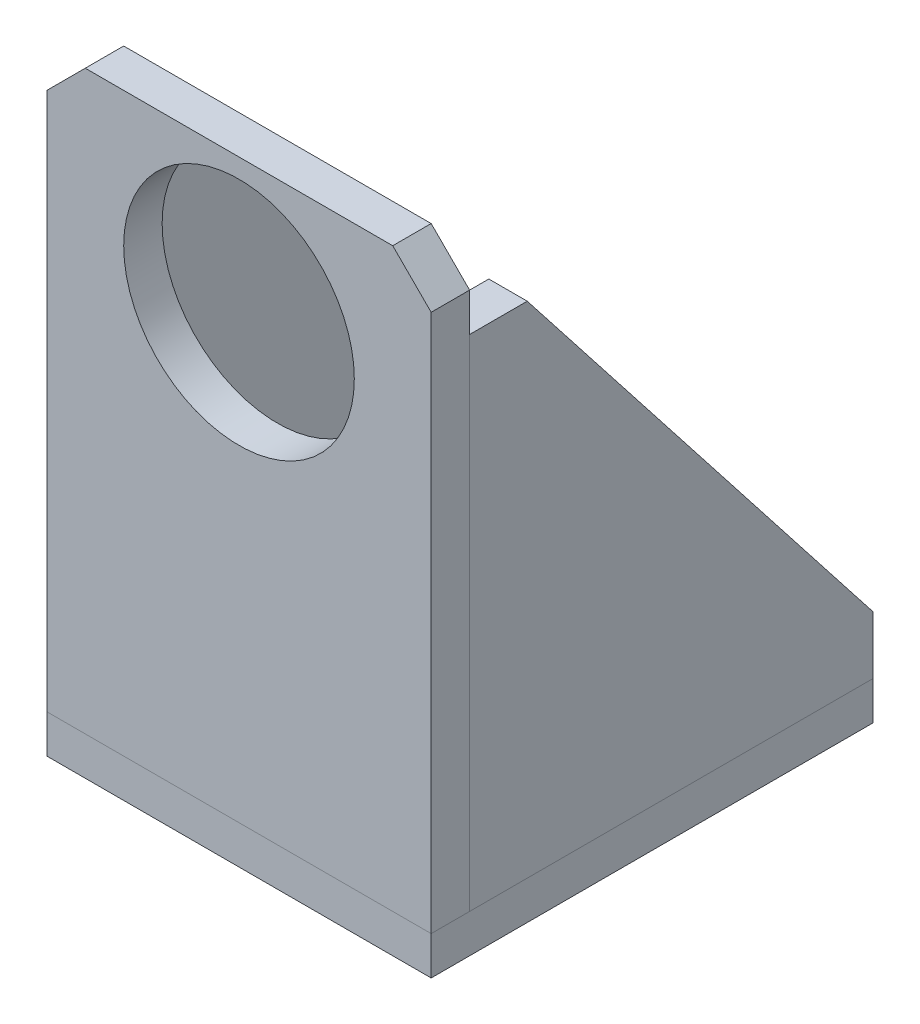
from build123d import *

# Parameters (mm, degrees)
SKETCH1_W           = 100
SKETCH1_H           = 150
BOSS_EXTRUDE1_DEPTH = 10
SKETCH3_W           = 100
SKETCH3_H           = 115
BOSS_EXTRUDE3_DEPTH = 10
BOSS_EXTRUDE4_DEPTH = 10
BOSS_EXTRUDE5_DEPTH = 10
CHAMFER1_SIZE       = 10
SKETCH6_R           = 30
CUT_EXTRUDE1_DEPTH  = 50


with BuildPart() as part:
    # Sketch1 → Boss-Extrude1 (new body)
    with BuildSketch(Plane.XY):
        with Locations((0, 75)):
            Rectangle(SKETCH1_W, SKETCH1_H)
    extrude(amount=BOSS_EXTRUDE1_DEPTH)

    # Chamfer1
    chamfer1_edges = [part.edges().sort_by_distance(p)[0] for p in [
        (-50, 150, 5),
        (50, 150, 5),
    ]]
    chamfer(chamfer1_edges, length=CHAMFER1_SIZE)

    # Sketch6 → Cut-Extrude1 (cut)
    with BuildSketch(Plane.XY.offset(10)):
        with Locations((0, 115)):
            Circle(SKETCH6_R)
    extrude(amount=-CUT_EXTRUDE1_DEPTH, mode=Mode.SUBTRACT)


with BuildPart() as body_2:
    # Sketch3 → Boss-Extrude3 (new body)
    with BuildSketch(Plane.XZ):
        with Locations((0, -47.5)):
            Rectangle(SKETCH3_W, SKETCH3_H)
    extrude(amount=BOSS_EXTRUDE3_DEPTH)


with BuildPart() as body_3:
    # Sketch4 → Boss-Extrude4 (new body)
    with BuildSketch(Plane(origin=(50, 0, 0), x_dir=(0, 0, -1), z_dir=(1, 0, 0))):
        Polygon((105, 0), (0, 0), (0, 130), (15, 130), (105, 15), align=None)
    extrude(amount=-BOSS_EXTRUDE4_DEPTH)


with BuildPart() as body_4:
    # Sketch5 → Boss-Extrude5 (new body)
    with BuildSketch(Plane.ZY.offset(50)):
        Polygon((0, 0), (0, 130), (-15, 130), (-105, 15), (-105, 0), align=None)
    extrude(amount=-BOSS_EXTRUDE5_DEPTH)


solid = Compound([part.part, body_2.part, body_3.part, body_4.part])
